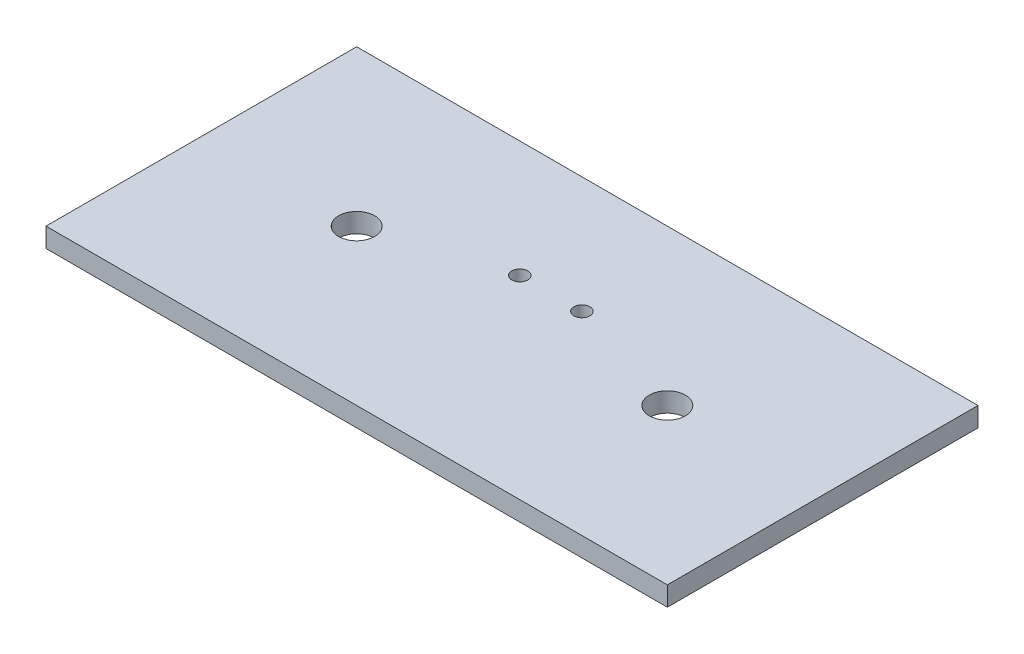
from build123d import *

# Parameters (mm, degrees)
SKETCH1_W             = 50.8
SKETCH1_H             = 25.4
BOSS_EXTRUDE1_DEPTH   = 1.5875
SKETCH2_R             = 0.65
CUT_EXTRUDE1_DEPTH    = 29.442400677
F_4_CLEARANCE_HOLE2_D = 2.9464


with BuildPart() as part:
    # Sketch1 → Boss-Extrude1 (new body)
    with BuildSketch(Plane(origin=(0, 0, 0), x_dir=(1, 0, 0), z_dir=(0, 1, 0))):
        Rectangle(SKETCH1_W, SKETCH1_H)
    extrude(amount=BOSS_EXTRUDE1_DEPTH)

    # Sketch2 → Cut-Extrude1 (cut, through all)
    with BuildSketch(Plane(origin=(0, 1.5875, 0), x_dir=(1, 0, 0), z_dir=(0, 1, 0))):
        with Locations(Location((-2.54, 3.175, 0), (0, 0, 270))):
            Circle(SKETCH2_R)
        with Locations(Location((2.54, 3.175, 0), (0, 0, 270))):
            Circle(SKETCH2_R)
    extrude(amount=-CUT_EXTRUDE1_DEPTH, mode=Mode.SUBTRACT)

    # #4 Clearance Hole2 (through all)
    with Locations(Plane(origin=(0, 1.5875, 0), x_dir=(1, 0, 0), z_dir=(0, 1, 0))):
        with Locations((-12.7, 0), (12.7, 0)):
            Hole(F_4_CLEARANCE_HOLE2_D / 2)


solid = part.part
